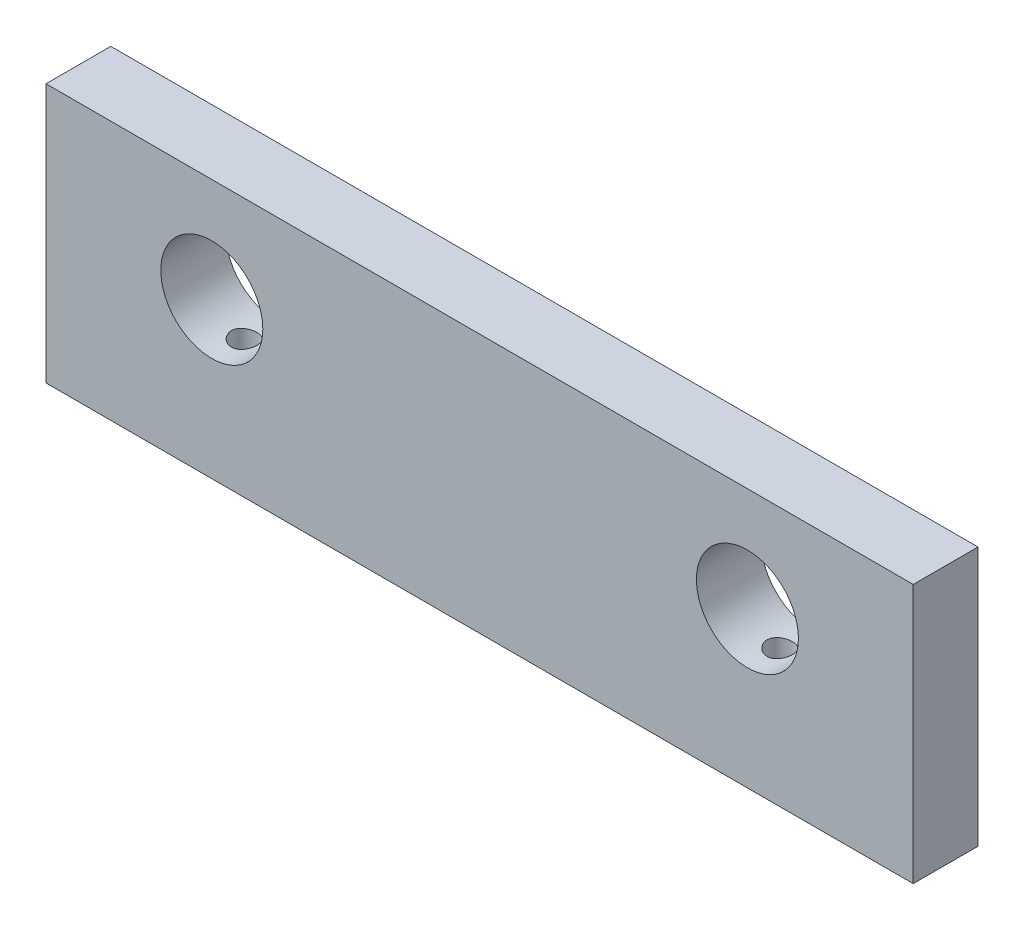
from build123d import *

# Parameters (mm, degrees)
CROQUIS1_W              = 170
CROQUIS1_H              = 50.8
CROQUIS1_R              = 10
SALIENTE_EXTRUIR1_DEPTH = 12.7
CROQUIS2_R              = 2.5
CORTAR_EXTRUIR1_DEPTH   = 32.7
CROQUIS3_R              = 2.5
CORTAR_EXTRUIR2_DEPTH   = 40


with BuildPart() as part:
    # Croquis1 → Saliente-Extruir1 (new body)
    with BuildSketch(Plane.XY):
        Rectangle(CROQUIS1_W, CROQUIS1_H)
        with Locations((52.5, 5)):
            Circle(CROQUIS1_R, mode=Mode.SUBTRACT)
        with Locations((-52.5, 5)):
            Circle(CROQUIS1_R, mode=Mode.SUBTRACT)
    extrude(amount=SALIENTE_EXTRUIR1_DEPTH)

    # Croquis2 → Cortar-Extruir1 (cut)
    with BuildSketch(Plane.XZ.offset(25.4)):
        with Locations((-52.5, 6.35)):
            Circle(CROQUIS2_R)
        with Locations((52.5, 6.35)):
            Circle(CROQUIS2_R)
    extrude(amount=-CORTAR_EXTRUIR1_DEPTH, mode=Mode.SUBTRACT)

    # Croquis3 → Cortar-Extruir2 (cut)
    with BuildSketch(Plane.XZ.offset(25.4)):
        with Locations((-73, 6.35)):
            Circle(CROQUIS3_R)
        with Locations(Location((73, 6.35, 0), (0, 0, 180))):
            Circle(CROQUIS3_R)
    extrude(amount=-CORTAR_EXTRUIR2_DEPTH, mode=Mode.SUBTRACT)


solid = part.part
